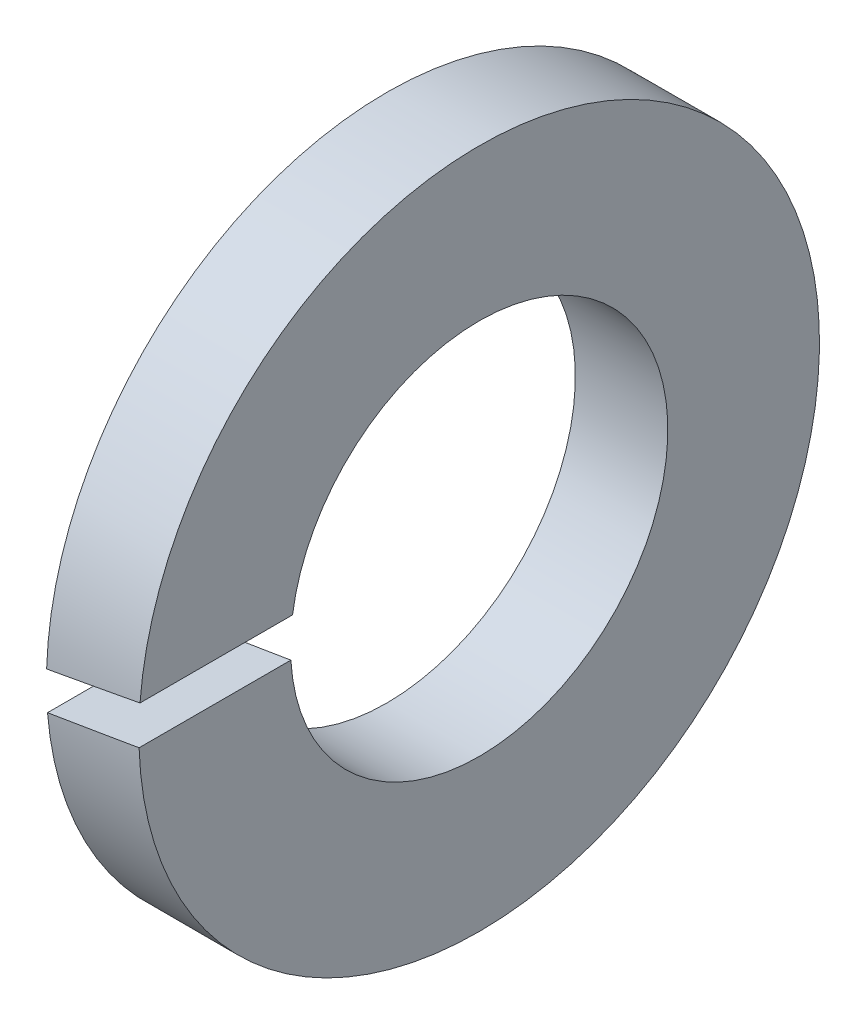
from build123d import *

# Parameters (mm, degrees)
SKETCH1_W          = 2.5
SKETCH1_H          = 4.1
CUT_EXTRUDE1_DEPTH = 18.4


with BuildPart() as part:
    # Sketch1 → Revolve1 (revolve)
    with BuildSketch(Plane.XY, mode=Mode.PRIVATE) as revolve1_sk:
        with Locations((0, 7.15)):
            Rectangle(SKETCH1_W, SKETCH1_H)
    revolve(revolve1_sk.sketch.rotate(Axis((1.25, 0, 0), (-1, 0, 0)), 90), axis=Axis((1.25, 0, 0), (-1, 0, 0)))

    # Sketch2 → Cut-Extrude1 (cut)
    with BuildSketch(Plane.XY):
        Polygon((-1.427121141, 0.26622761), (-1.25, -0.738276298), (1.427121141, -0.26622761), (1.25, 0.738276298), align=None)
    extrude(amount=CUT_EXTRUDE1_DEPTH, mode=Mode.SUBTRACT)


solid = part.part
